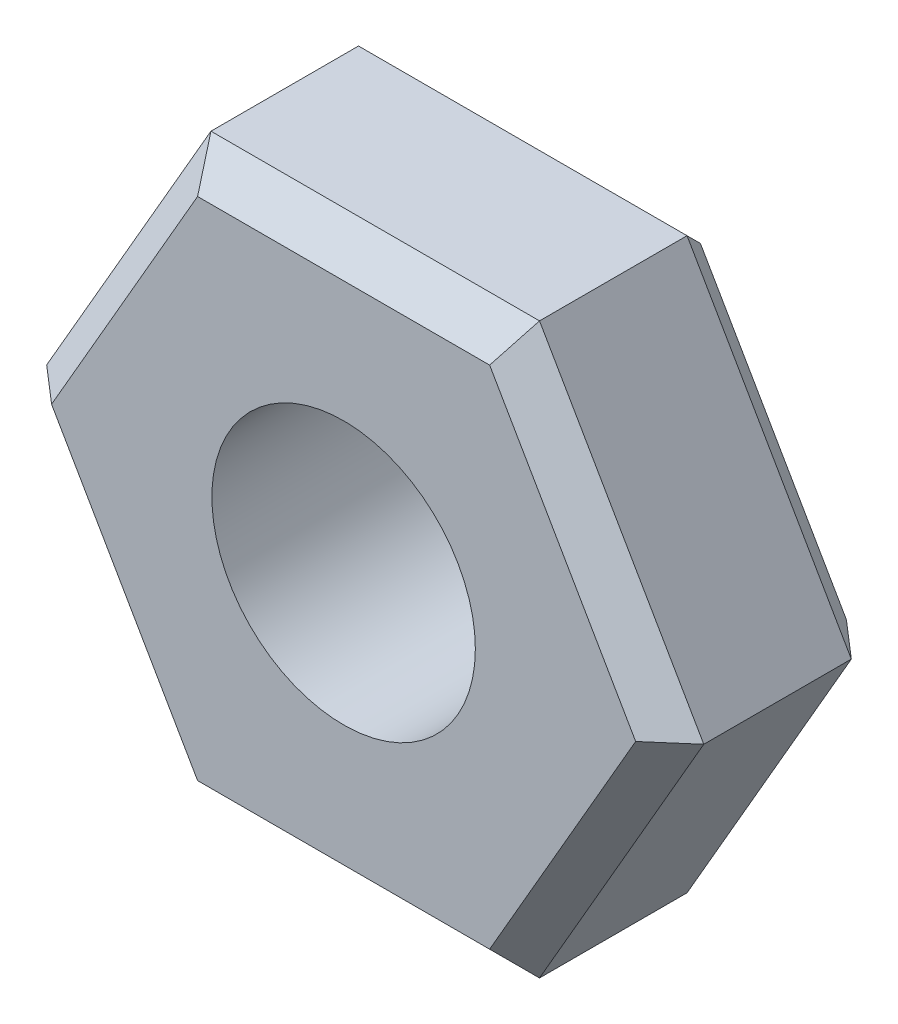
from build123d import *

# Parameters (mm, degrees)
SKETCH1_R           = 1.25
BOSS_EXTRUDE1_DEPTH = 1
CHAMFER1_SIZE       = 0.3


with BuildPart() as part:
    # Sketch1 → Boss-Extrude1 (new, symmetric)
    with BuildSketch(Plane.XY):
        Polygon((3.117691454, 0), (1.558845727, 2.7), (-1.558845727, 2.7), (-3.117691454, 0), (-1.558845727, -2.7), (1.558845727, -2.7), align=None)
        Circle(SKETCH1_R, mode=Mode.SUBTRACT)
    extrude(amount=BOSS_EXTRUDE1_DEPTH, both=True)

    # Chamfer1
    chamfer1_edges = [part.edges().sort_by_distance(p)[0] for p in [
        (0, 2.7, 1),
        (-2.33826859, 1.35, 1),
        (-2.33826859, -1.35, 1),
        (0, -2.7, 1),
        (2.33826859, -1.35, 1),
        (0, -2.7, -1),
        (-2.33826859, -1.35, -1),
        (-2.33826859, 1.35, -1),
        (0, 2.7, -1),
        (2.33826859, 1.35, -1),
        (2.33826859, -1.35, -1),
        (2.33826859, 1.35, 1),
    ]]
    chamfer(chamfer1_edges, length=CHAMFER1_SIZE)


solid = part.part
